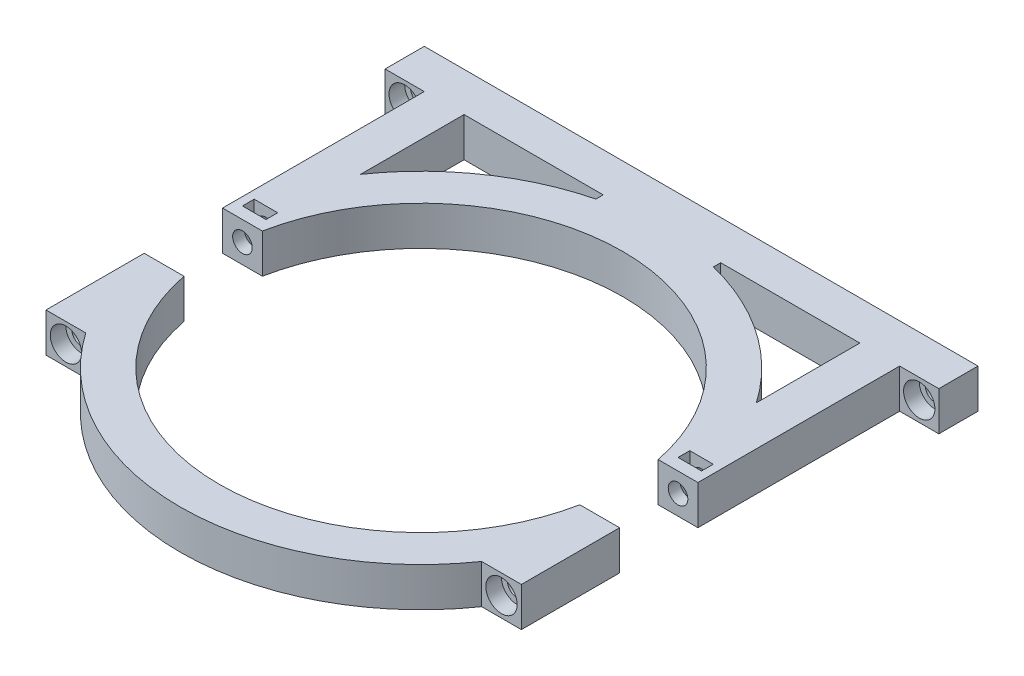
from build123d import *

# Parameters (mm, degrees)
BOSS_EXTRUDE1_DEPTH   = 10
BOSS_EXTRUDE1_2_DEPTH = 10
SKETCH2_R             = 2.5
CUT_EXTRUDE1_DEPTH    = 10
SKETCH3_R             = 4
CUT_EXTRUDE2_DEPTH    = 4
SKETCH4_R             = 2.5
CUT_EXTRUDE3_DEPTH    = 70
SKETCH5_R             = 4
CUT_EXTRUDE4_DEPTH    = 4
CUT_EXTRUDE5_START    = -10
SKETCH6_W             = 6
SKETCH6_H             = 3
CUT_EXTRUDE5_DEPTH    = 10
SKETCH7_R             = 2.5
CUT_EXTRUDE6_DEPTH    = 70
SKETCH8_R             = 4
CUT_EXTRUDE7_DEPTH    = 4
CUT_EXTRUDE8_START    = -10
SKETCH11_W            = 6
SKETCH11_H            = 3
CUT_EXTRUDE8_DEPTH    = 10


with BuildPart() as part:
    # Sketch1 → Boss-Extrude1 (new body)
    with BuildSketch(Plane(origin=(0, 0, 0), x_dir=(1, 0, 0), z_dir=(0, 1, 0))):
        with BuildLine():
            ThreePointArc((50.519798099, 10), (0, 51.5), (-50.519798099, 10))
            Line((-50.519798099, 10), (-60.681545794, 10))
            Line((-60.681545794, 10), (-60.681545794, 61.5))
            Line((-60.681545794, 61.5), (-70.681545794, 61.5))
            Line((-70.681545794, 61.5), (-70.681545794, 71.5))
            Line((-70.681545794, 71.5), (70.681545794, 71.5))
            Line((70.681545794, 71.5), (70.681545794, 61.5))
            Line((70.681545794, 61.5), (60.681545794, 61.5))
            Line((60.681545794, 61.5), (60.681545794, 10))
            Line((60.681545794, 10), (50.519798099, 10))
        make_face()
        with BuildLine():
            Line((50.519798099, 61.5), (50.519798099, 35.071355834))
            ThreePointArc((50.519798099, 35.071355834), (34.987834357, 50.577677359), (15, 59.642686056))
            Line((15, 59.642686056), (15, 61.5))
            Line((15, 61.5), (50.519798099, 61.5))
        make_face(mode=Mode.SUBTRACT)
        with BuildLine():
            Line((-15, 61.5), (-15, 59.642686056))
            ThreePointArc((-15, 59.642686056), (-34.987834357, 50.577677359), (-50.519798099, 35.071355834))
            Line((-50.519798099, 35.071355834), (-50.519798099, 61.5))
            Line((-50.519798099, 61.5), (-15, 61.5))
        make_face(mode=Mode.SUBTRACT)
    extrude(amount=BOSS_EXTRUDE1_DEPTH)

    # Sketch2 → Cut-Extrude1 (cut)
    with BuildSketch(Plane.XY.offset(-61.5)):
        with Locations((-65.681545794, 5)):
            Circle(SKETCH2_R)
        with Locations((65.681545794, 5)):
            Circle(SKETCH2_R)
    extrude(amount=-CUT_EXTRUDE1_DEPTH, mode=Mode.SUBTRACT)

    # Sketch3 → Cut-Extrude2 (cut)
    with BuildSketch(Plane.XY.offset(-61.5)):
        with Locations((-65.681545794, 5)):
            Circle(SKETCH3_R)
        with Locations((65.681545794, 5)):
            Circle(SKETCH3_R)
    extrude(amount=-CUT_EXTRUDE2_DEPTH, mode=Mode.SUBTRACT)


with BuildPart() as body_2:
    # Sketch1 → Boss-Extrude1 2 (new body)
    with BuildSketch(Plane(origin=(0, 0, 0), x_dir=(1, 0, 0), z_dir=(0, 1, 0))):
        with BuildLine():
            ThreePointArc((-50.519798099, -10), (0, -51.5), (50.519798099, -10))
            Line((50.519798099, -10), (60.681545794, -10))
            Line((60.681545794, -10), (60.681545794, -35.071355834))
            Line((60.681545794, -35.071355834), (50.519798099, -35.071355834))
            ThreePointArc((50.519798099, -35.071355834), (0, -61.5), (-50.519798099, -35.071355834))
            Line((-50.519798099, -35.071355834), (-60.681545794, -35.071355834))
            Line((-60.681545794, -35.071355834), (-60.681545794, -10))
            Line((-60.681545794, -10), (-50.519798099, -10))
        make_face()
    extrude(amount=BOSS_EXTRUDE1_2_DEPTH)


with BuildPart() as cut_extrude3_tool:
    # Sketch4 → Cut-Extrude3 (new body)
    with BuildSketch(Plane.XY.offset(35.071355834)):
        with Locations((-55.600671947, 5)):
            Circle(SKETCH4_R)
    extrude(amount=-CUT_EXTRUDE3_DEPTH)


with BuildPart() as part_1:
    add(part.part)

    # Cut-Extrude3: cut by cut_extrude3_tool
    add(cut_extrude3_tool.part, mode=Mode.SUBTRACT)

    # Sketch6 → Cut-Extrude5 (cut)
    with BuildSketch(Plane(origin=(0, 10, 0), x_dir=(1, 0, 0), z_dir=(0, 1, 0)).offset(CUT_EXTRUDE5_START)):
        with Locations((-55.600671947, 14.5)):
            Rectangle(SKETCH6_W, SKETCH6_H)
    extrude(amount=CUT_EXTRUDE5_DEPTH, mode=Mode.SUBTRACT)


with BuildPart() as body_2_1:
    add(body_2.part)

    # Cut-Extrude3: cut by cut_extrude3_tool
    add(cut_extrude3_tool.part, mode=Mode.SUBTRACT)

    # Sketch5 → Cut-Extrude4 (cut)
    with BuildSketch(Plane.XY.offset(35.071355834)):
        with Locations((-55.600671947, 5)):
            Circle(SKETCH5_R)
    extrude(amount=-CUT_EXTRUDE4_DEPTH, mode=Mode.SUBTRACT)


with BuildPart() as cut_extrude6_tool:
    # Sketch7 → Cut-Extrude6 (new body)
    with BuildSketch(Plane.XY.offset(35.071355834)):
        with Locations((55.600671947, 5)):
            Circle(SKETCH7_R)
    extrude(amount=-CUT_EXTRUDE6_DEPTH)


with BuildPart() as part_2:
    add(part_1.part)

    # Cut-Extrude6: cut by cut_extrude6_tool
    add(cut_extrude6_tool.part, mode=Mode.SUBTRACT)

    # Sketch11 → Cut-Extrude8 (cut)
    with BuildSketch(Plane(origin=(0, 10, 0), x_dir=(1, 0, 0), z_dir=(0, 1, 0)).offset(CUT_EXTRUDE8_START)):
        with Locations((55.600671947, 14.5)):
            Rectangle(SKETCH11_W, SKETCH11_H)
    extrude(amount=CUT_EXTRUDE8_DEPTH, mode=Mode.SUBTRACT)


with BuildPart() as body_2_2:
    add(body_2_1.part)

    # Cut-Extrude6: cut by cut_extrude6_tool
    add(cut_extrude6_tool.part, mode=Mode.SUBTRACT)

    # Sketch8 → Cut-Extrude7 (cut)
    with BuildSketch(Plane.XY.offset(35.071355834)):
        with Locations((55.600671947, 5)):
            Circle(SKETCH8_R)
    extrude(amount=-CUT_EXTRUDE7_DEPTH, mode=Mode.SUBTRACT)


solid = Compound([part_2.part, body_2_2.part])
